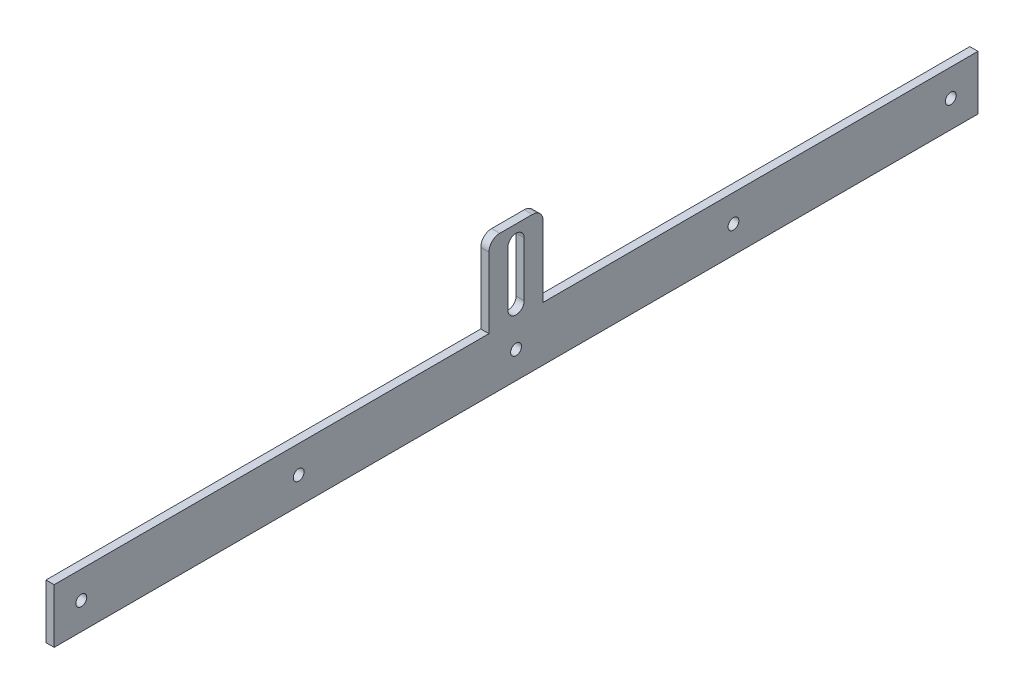
from build123d import *

# Parameters (mm, degrees)
SKETCH1_W           = 340
SKETCH1_H           = 20
BOSS_EXTRUDE1_DEPTH = 3
SKETCH2_R           = 2
CUT_EXTRUDE1_DEPTH  = 10
BOSS_EXTRUDE4_DEPTH = 3


with BuildPart() as part:
    # Sketch1 → Boss-Extrude1 (new body)
    with BuildSketch(Plane(origin=(0, 0, 0), x_dir=(0, 0, -1), z_dir=(1, 0, 0))):
        with Locations((170, 10)):
            Rectangle(SKETCH1_W, SKETCH1_H)
    extrude(amount=BOSS_EXTRUDE1_DEPTH)

    # Sketch2 → Cut-Extrude1 (cut)
    with BuildSketch(Plane(origin=(3, 0, 0), x_dir=(0, 0, -1), z_dir=(1, 0, 0))):
        with Locations((10, 10)):
            Circle(SKETCH2_R)
        with Locations((90, 10)):
            Circle(SKETCH2_R)
        with Locations((170, 10)):
            Circle(SKETCH2_R)
        with Locations((250, 10)):
            Circle(SKETCH2_R)
        with Locations((330, 10)):
            Circle(SKETCH2_R)
    extrude(amount=-CUT_EXTRUDE1_DEPTH, mode=Mode.SUBTRACT)

    # Sketch3 → Boss-Extrude4 (add)
    with BuildSketch(Plane(origin=(3, 0, 0), x_dir=(0, 0, -1), z_dir=(1, 0, 0))):
        with BuildLine():
            Line((160, 46), (160, 20))
            Line((160, 20), (180, 20))
            Line((180, 20), (180, 46))
            ThreePointArc((180, 46), (178.828427125, 48.828427125), (176, 50))
            Line((176, 50), (164, 50))
            ThreePointArc((164, 50), (161.171572875, 48.828427125), (160, 46))
        make_face()
        with BuildLine():
            ThreePointArc((167, 44), (170, 47), (173, 44))
            Line((173, 44), (173, 24))
            ThreePointArc((173, 24), (170, 21), (167, 24))
            Line((167, 24), (167, 44))
        make_face(mode=Mode.SUBTRACT)
    extrude(amount=-BOSS_EXTRUDE4_DEPTH)


solid = part.part
